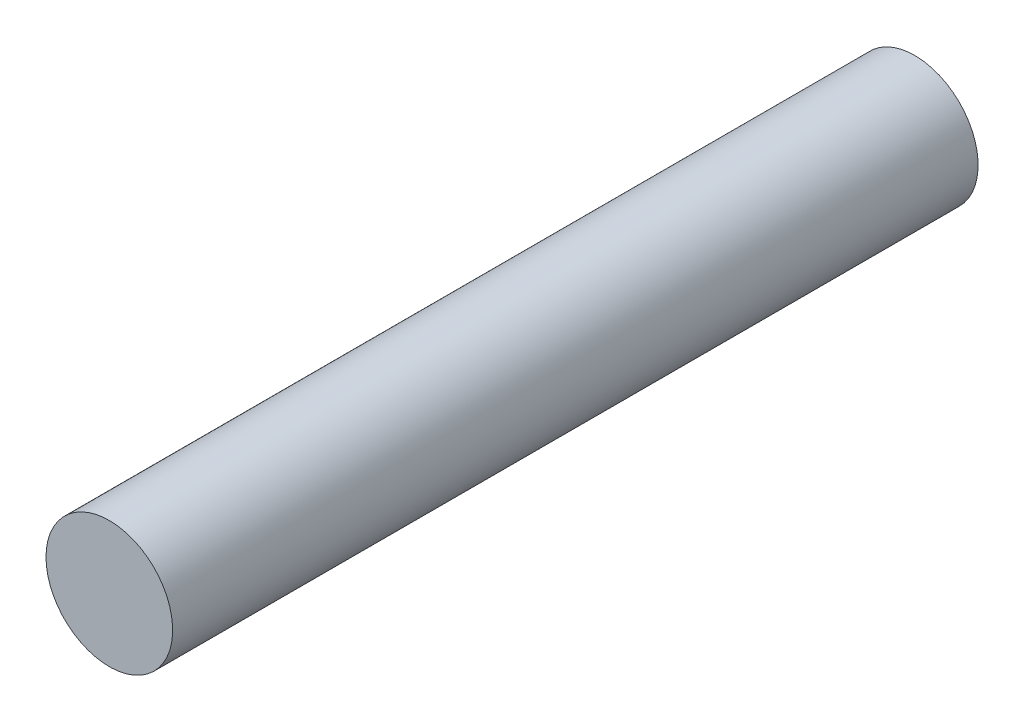
from build123d import *

# Parameters (mm, degrees)
ESQUISSE1_R        = 12.5
BOSS_EXTRU_2_DEPTH = 159


with BuildPart() as part:
    # Esquisse1 → Boss.-Extru.2 (new body)
    with BuildSketch(Plane(origin=(0, 0, 0), x_dir=(0, 1, 0), z_dir=(0, 0, 1))):
        with Locations(Location((0, 0, 0), (0, 0, 90))):
            Circle(ESQUISSE1_R)
    extrude(amount=BOSS_EXTRU_2_DEPTH)


solid = part.part
